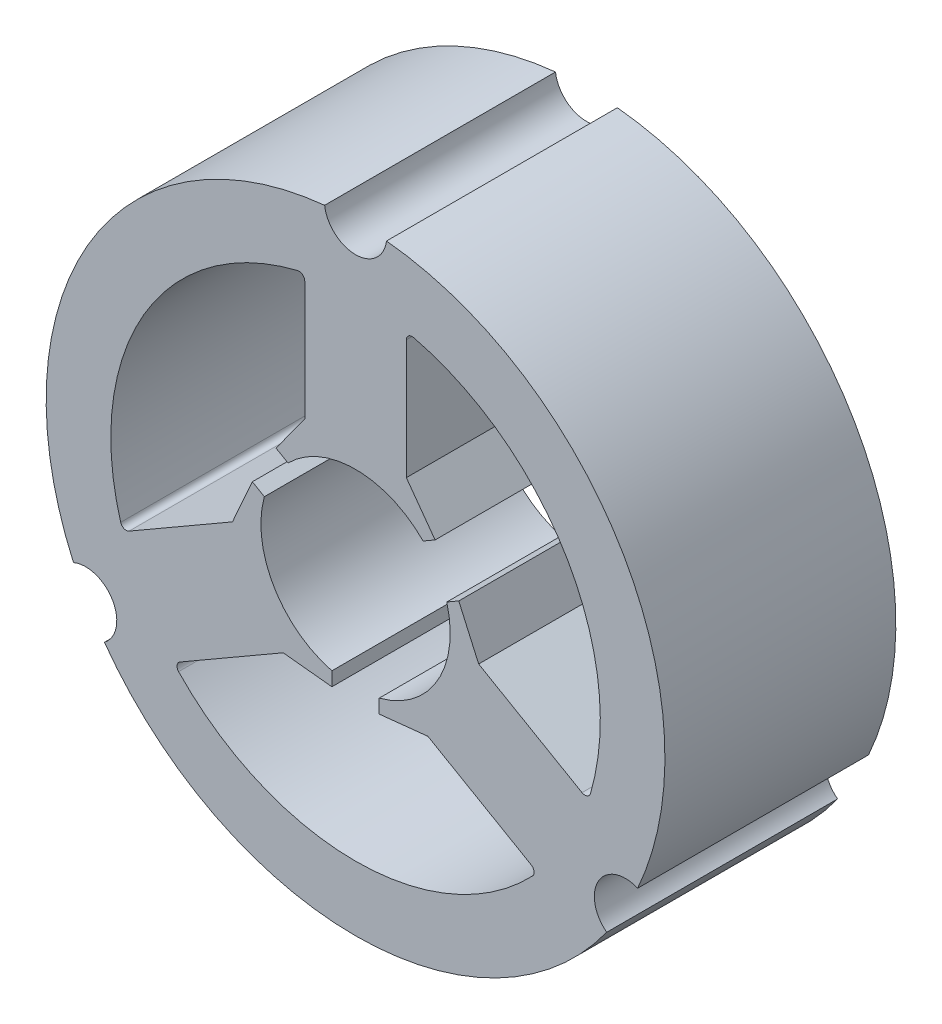
from build123d import *

# Parameters (mm, degrees)
SKETCH_1_R               = 4.1
EXTRUDE_1_DEPTH          = 10
CUT_EXTRUDE_1_DEPTH      = 10
PATTERN_CIRCULAR_1_COUNT = 3


with BuildPart() as part:
    # 草图1 → 凸台-拉伸1 (new body)
    with BuildSketch(Plane.XY):
        with BuildLine():
            ThreePointArc((-1.339614753, 13.33287037), (-11.604740411, 6.7), (-12.216411823, -5.506294778))
            ThreePointArc((-12.216411823, -5.506294778), (-10.522208656, -6.075), (-10.87679707, -7.826575593))
            ThreePointArc((-10.87679707, -7.826575593), (0, -13.4), (10.87679707, -7.826575593))
            ThreePointArc((10.87679707, -7.826575593), (10.522208656, -6.075), (12.216411823, -5.506294778))
            ThreePointArc((12.216411823, -5.506294778), (11.604740411, 6.7), (1.339614753, 13.33287037))
            ThreePointArc((1.339614753, 13.33287037), (0, 12.15), (-1.339614753, 13.33287037))
        make_face()
        Circle(SKETCH_1_R, mode=Mode.SUBTRACT)
    extrude(amount=EXTRUDE_1_DEPTH)

    # 草图2 → 切除-拉伸1 (cut)
    with BuildSketch(Plane.XY):
        with BuildLine():
            Line((-7.608616423, -6.933177924), (-3.131635256, -4.348391642))
            Line((-3.131635256, -4.348391642), (-1.025, -4.56980793))
            Line((-1.025, -4.56980793), (-1.025, -3.96980793))
            ThreePointArc((-1.025, -3.96980793), (0, -4.1), (1.025, -3.96980793))
            Line((1.025, -3.96980793), (1.025, -4.56980793))
            Line((1.025, -4.56980793), (3.131635256, -4.348391642))
            Line((3.131635256, -4.348391642), (7.608616423, -6.933177924))
            ThreePointArc((7.608616423, -6.933177924), (7.731089256, -7.114227304), (7.664380105, -7.322381963))
            ThreePointArc((7.664380105, -7.322381963), (0, -10.6), (-7.664380105, -7.322381963))
            ThreePointArc((-7.664380105, -7.322381963), (-7.731089256, -7.114227304), (-7.608616423, -6.933177924))
        make_face()
    cut_extrude_1 = extrude(amount=CUT_EXTRUDE_1_DEPTH, mode=Mode.SUBTRACT)

    # 阵列(圆周)1: 切除-拉伸1 ×3 about axis
    pattern_circular_1_axis = Axis((0, 0, 0), (0, 0, 1))
    for i in range(1, PATTERN_CIRCULAR_1_COUNT):
        add(cut_extrude_1.rotate(pattern_circular_1_axis, i * 360 / PATTERN_CIRCULAR_1_COUNT), mode=Mode.SUBTRACT)


solid = part.part
